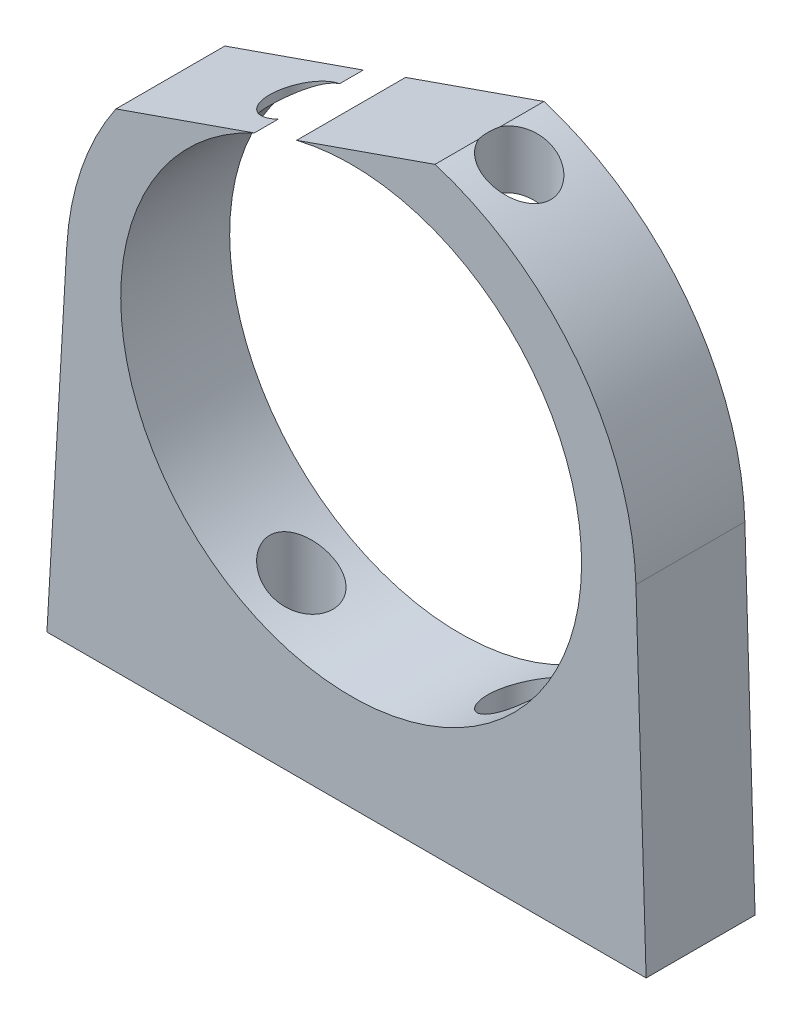
from build123d import *

# Parameters (mm, degrees)
SKETCH_1_R          = 21.15
EXTRUDE_1_DEPTH     = 10
SKETCH_2_R          = 1.6
CUT_EXTRUDE_1_DEPTH = 64.50267784
CUT_EXTRUDE_START   = -5
SKETCH_3_R          = 2.9
CUT_EXTRUDE_2_DEPTH = 59.502677944
CUT_EXTRUDE_5_DEPTH = 43.187291864


with BuildPart() as part:
    # 草图1 → 凸台-拉伸1 (new body)
    with BuildSketch(Plane.XY):
        with BuildLine():
            Line((-27.924319022, -30), (27.075680978, -30))
            Line((27.075680978, -30), (26.137883686, 0.795950004))
            ThreePointArc((26.137883686, 0.795950004), (0.355472008, 26.147583821), (-26.106586279, 1.506204794))
            Line((-26.106586279, 1.506204794), (-27.924319022, -30))
        make_face()
        Circle(SKETCH_1_R, mode=Mode.SUBTRACT)
    extrude(amount=EXTRUDE_1_DEPTH)

    # 草图2 → 切除-拉伸1 (cut, through all)
    with BuildSketch(Plane.XZ.offset(30)):
        with Locations(Location((10.425680978, 5, 0), (0, 0, 270))):
            Circle(SKETCH_2_R)
        with Locations(Location((-9.574319022, 5, 0), (0, 0, 270))):
            Circle(SKETCH_2_R)
    extrude(amount=-CUT_EXTRUDE_1_DEPTH, mode=Mode.SUBTRACT)

    # 草图3 → 切除-拉伸2 (cut, through all)
    with BuildSketch(Plane.XZ.offset(30).offset(CUT_EXTRUDE_START)):
        with Locations(Location((10.425680978, 5, 0), (0, 0, 270))):
            Circle(SKETCH_3_R)
        with Locations(Location((-9.574319022, 5, 0), (0, 0, 270))):
            Circle(SKETCH_3_R)
    extrude(amount=-CUT_EXTRUDE_2_DEPTH, mode=Mode.SUBTRACT)

    # 草图4 → 切除-拉伸5 (cut, through all)
    with BuildSketch(Plane(origin=(0, 0, 0), x_dir=(-1, 0, 0), z_dir=(0, 0, -1))):
        with BuildLine():
            Line((-7.858993685, 25.04593217), (21.750509975, 14.696183717))
            ThreePointArc((21.750509975, 14.696183717), (8.661574884, 24.779822851), (-7.858993685, 25.04593217))
        make_face()
    extrude(amount=-CUT_EXTRUDE_5_DEPTH, mode=Mode.SUBTRACT)


solid = part.part
